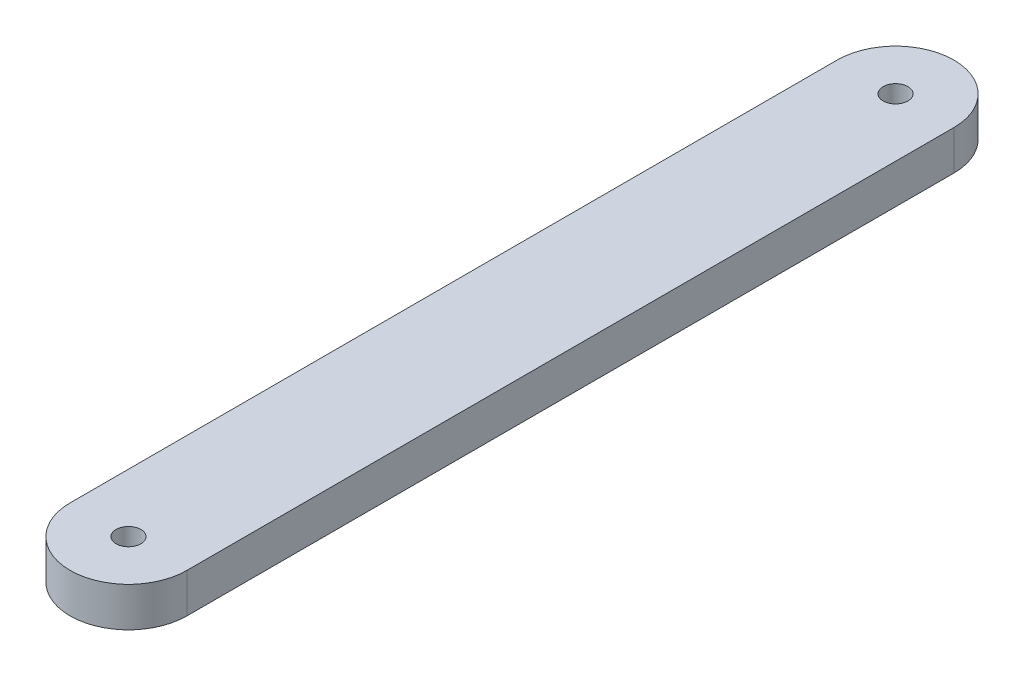
from build123d import *

# Parameters (mm, degrees)
BOSS_EXTRUDE1_DEPTH      = 6.35
F_4_0_4_DIAMETER_HOLE1_D = 4


with BuildPart() as part:
    # Sketch1 → Boss-Extrude1 (new body)
    with BuildSketch(Plane(origin=(0, 0, 0), x_dir=(1, 0, 0), z_dir=(0, 1, 0))):
        with BuildLine():
            Line((-9.403230985, -61.722), (-9.403230985, 61.722))
            ThreePointArc((-9.403230985, 61.722), (0, 71.125230985), (9.403230985, 61.722))
            Line((9.403230985, 61.722), (9.403230985, -61.722))
            ThreePointArc((9.403230985, -61.722), (0, -71.125230985), (-9.403230985, -61.722))
        make_face()
    extrude(amount=BOSS_EXTRUDE1_DEPTH)

    # Ø4.0 (4) Diameter Hole1 (through all)
    with Locations(Plane(origin=(0, 6.35, 0), x_dir=(1, 0, 0), z_dir=(0, 1, 0))):
        with Locations((0, -61.722), (0, 61.722)):
            Hole(F_4_0_4_DIAMETER_HOLE1_D / 2)


solid = part.part
